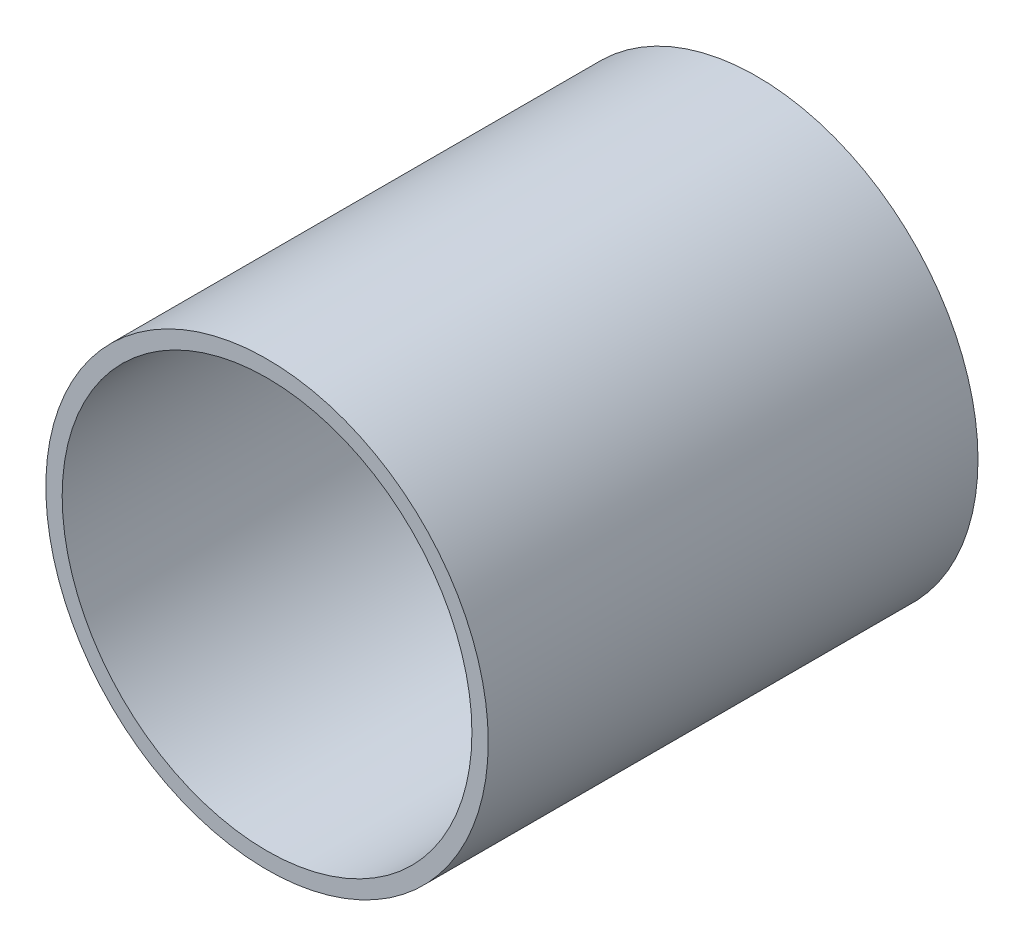
from build123d import *

# Parameters (mm, degrees)
SKETCH_1_R      = 13.55
SKETCH_1_R_2    = 12.55
EXTRUDE_1_DEPTH = 30


with BuildPart() as part:
    # Эскиз1 → Бобышка-Вытянуть1 (new body)
    with BuildSketch(Plane.XY):
        Circle(SKETCH_1_R)
        Circle(SKETCH_1_R_2, mode=Mode.SUBTRACT)
    extrude(amount=EXTRUDE_1_DEPTH)


solid = part.part
